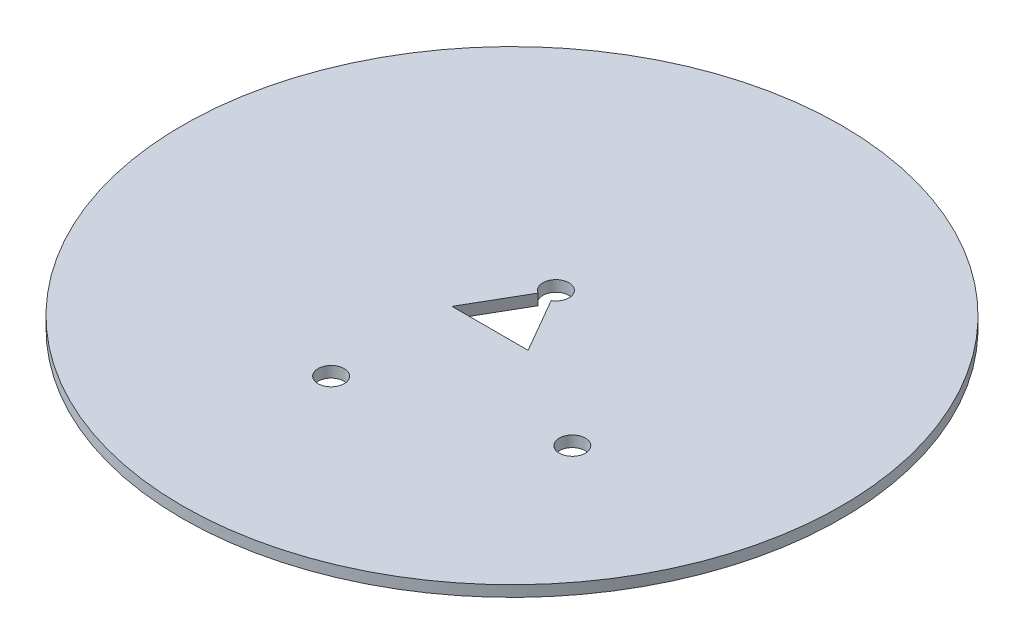
from build123d import *

# Parameters (mm, degrees)
ESQUISSE1_R        = 300
ESQUISSE1_R_2      = 11.902763715
BOSS_EXTRU_1_DEPTH = 10


with BuildPart() as part:
    # Esquisse1 → Boss.-Extru.1 (new body)
    with BuildSketch(Plane(origin=(0, 0, 0), x_dir=(1, 0, 0), z_dir=(0, 1, 0))):
        with Locations(Location((0, 0, 0), (0, 0, 270))):
            Circle(ESQUISSE1_R)
        with Locations(Location((-34.641016151, -130, 0), (0, 0, 270))):
            Circle(ESQUISSE1_R_2, mode=Mode.SUBTRACT)
        with Locations(Location((129.903810568, -75, 0), (0, 0, 270))):
            Circle(ESQUISSE1_R_2, mode=Mode.SUBTRACT)
        with BuildLine():
            Line((-34.641016151, -20), (-5.951381857, 29.691904248))
            ThreePointArc((-5.951381857, 29.691904248), (-5.951381857, 50.308095752), (11.902763715, 40))
            ThreePointArc((11.902763715, 40), (10.308095752, 34.048618143), (5.951381857, 29.691904248))
            Line((5.951381857, 29.691904248), (34.641016151, -20))
            Line((34.641016151, -20), (-34.641016151, -20))
        make_face(mode=Mode.SUBTRACT)
    extrude(amount=BOSS_EXTRU_1_DEPTH)


solid = part.part
